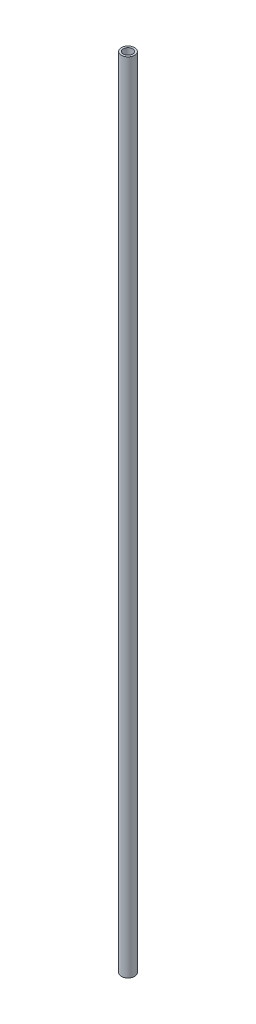
from build123d import *

# Parameters (mm, degrees)
SKETCH1_R           = 5
SKETCH1_R_2         = 3.5
BOSS_EXTRUDE1_DEPTH = 600


with BuildPart() as part:
    # Sketch1 → Boss-Extrude1 (new body)
    with BuildSketch(Plane(origin=(0, 0, 0), x_dir=(1, 0, 0), z_dir=(0, 1, 0))):
        with Locations(Location((0, 0, 0), (0, 0, 270))):
            Circle(SKETCH1_R)
        with Locations(Location((0, 0, 0), (0, 0, 270))):
            Circle(SKETCH1_R_2, mode=Mode.SUBTRACT)
    extrude(amount=BOSS_EXTRUDE1_DEPTH)


solid = part.part
